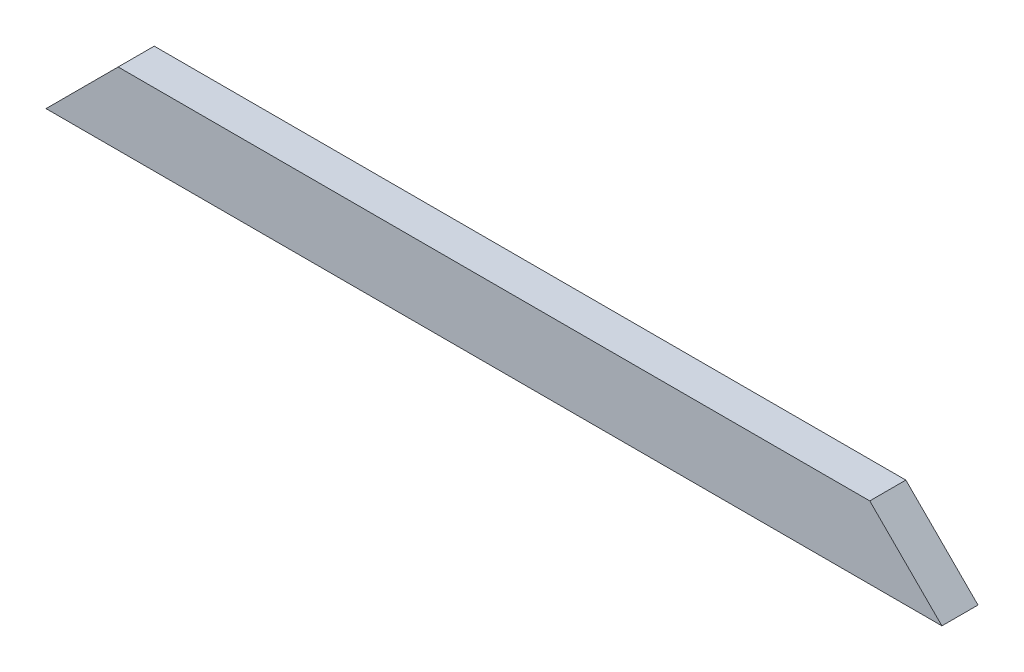
from build123d import *

# Parameters (mm, degrees)
BOSS_EXTRUDE1_DEPTH = 19.05


with BuildPart() as part:
    # Sketch1 → Boss-Extrude1 (new body)
    with BuildSketch(Plane.XY):
        Polygon((0, 0), (38.1, 38.1), (434.975, 38.1), (473.075, 0), align=None)
    extrude(amount=BOSS_EXTRUDE1_DEPTH)


solid = part.part
